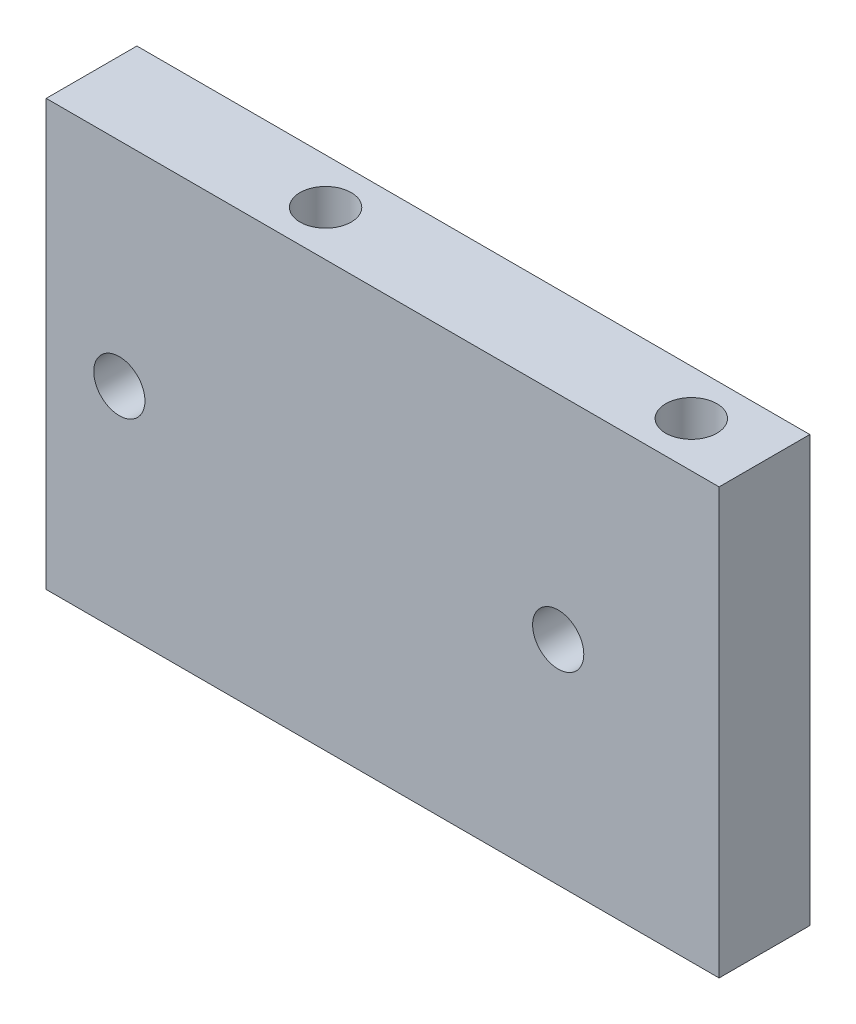
from build123d import *

# Parameters (mm, degrees)
SKETCH1_W         = 46
SKETCH1_H         = 29.075
EXTRUDE_1_4_DEPTH = 6.2
SKETCH2_R         = 1.75
M4_DRILL_DEPTH    = 6.2
SKETCH3_R         = 1.75
M4_DRILL2_DEPTH   = 8
M4_DRILL3_START   = -8
SKETCH4_R         = 1.75
M4_DRILL3_DEPTH   = 8


with BuildPart() as part:
    # Sketch1 → 1/4 (new body)
    with BuildSketch(Plane.XY):
        Rectangle(SKETCH1_W, SKETCH1_H)
    extrude(amount=EXTRUDE_1_4_DEPTH)

    # Sketch2 → M4_DRILL (cut)
    with BuildSketch(Plane.XY):
        with Locations((-18, 0)):
            Circle(SKETCH2_R)
        with Locations((12, 0)):
            Circle(SKETCH2_R)
    extrude(amount=M4_DRILL_DEPTH, mode=Mode.SUBTRACT)

    # Sketch3 → M4_DRILL2 (cut)
    with BuildSketch(Plane.XZ.offset(14.5375)):
        with Locations(Location((-7, 3.1, 0), (0, 0, 270))):
            Circle(SKETCH3_R)
        with Locations(Location((18, 3.1, 0), (0, 0, 270))):
            Circle(SKETCH3_R)
    extrude(amount=-M4_DRILL2_DEPTH, mode=Mode.SUBTRACT)

    # Sketch4 → M4_DRILL3 (cut)
    with BuildSketch(Plane(origin=(0, 14.5375, 0), x_dir=(1, 0, 0), z_dir=(0, 1, 0)).offset(M4_DRILL3_START)):
        with Locations(Location((18, -3.1, 0), (0, 0, 90))):
            Circle(SKETCH4_R)
        with Locations(Location((-7, -3.1, 0), (0, 0, 90))):
            Circle(SKETCH4_R)
    extrude(amount=M4_DRILL3_DEPTH, mode=Mode.SUBTRACT)


solid = part.part
